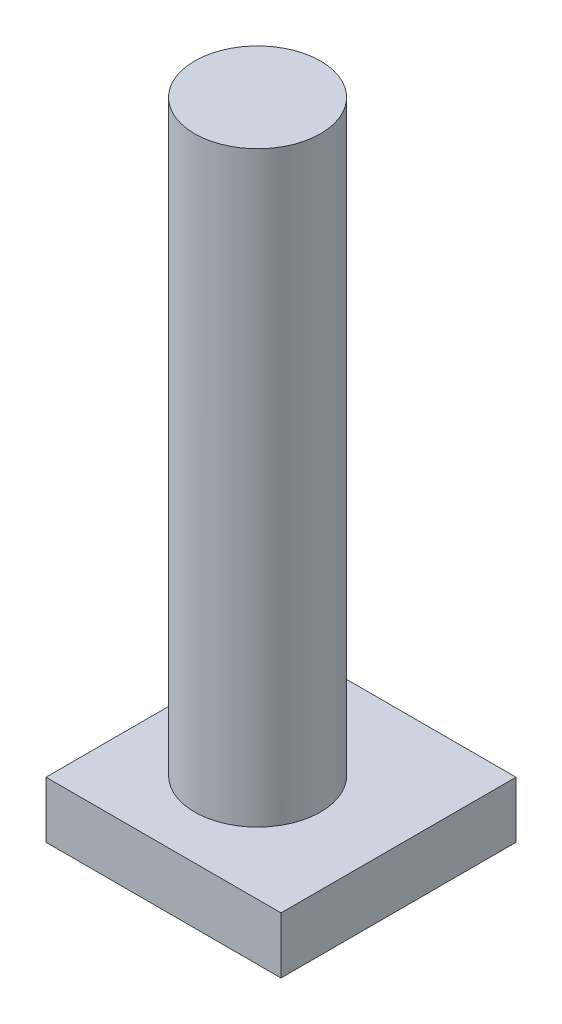
from build123d import *

# Parameters (mm, degrees)
SKETCH1_W           = 25.4
SKETCH1_H           = 25.4
BOSS_EXTRUDE1_DEPTH = 6.096
SKETCH2_R           = 6.809193443
BOSS_EXTRUDE2_DEPTH = 63.5


with BuildPart() as part:
    # Sketch1 → Boss-Extrude1 (new body)
    with BuildSketch(Plane(origin=(0, 0, 0), x_dir=(1, 0, 0), z_dir=(0, 1, 0))):
        with Locations((12.7, 12.7)):
            Rectangle(SKETCH1_W, SKETCH1_H)
    extrude(amount=BOSS_EXTRUDE1_DEPTH)

    # Sketch2 → Boss-Extrude2 (add)
    with BuildSketch(Plane(origin=(0, 6.096, 0), x_dir=(1, 0, 0), z_dir=(0, 1, 0))):
        with Locations(Location((11.292707797, 11.575842774, 0), (0, 0, 90))):
            Circle(SKETCH2_R)
    extrude(amount=BOSS_EXTRUDE2_DEPTH)


solid = part.part
